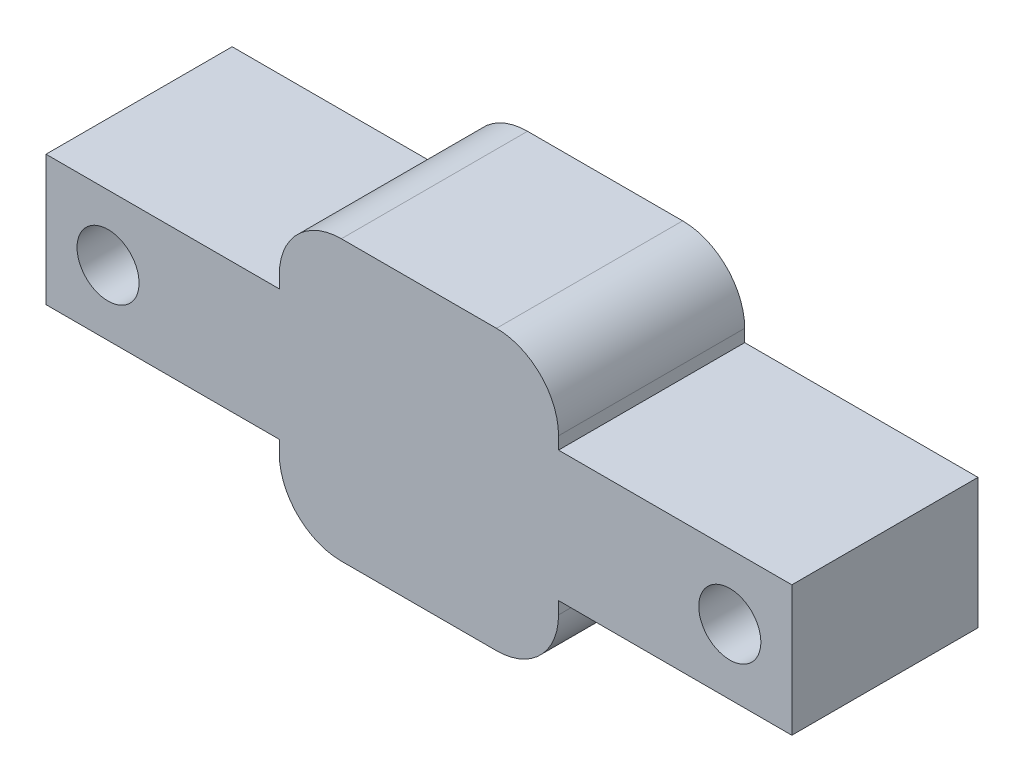
from build123d import *

# Parameters (mm, degrees)
SKETCH2_W           = 28.575
SKETCH2_H           = 28.575
BOSS_EXTRUDE2_DEPTH = 19.05
SKETCH1_R           = 13.335
CUT_EXTRUDE4_DEPTH  = 1.5875
FILLET2_R           = 6.35
SKETCH3_W           = 19.05
SKETCH3_H           = 13.335
BOSS_EXTRUDE3_DEPTH = 23.876
SKETCH4_R           = 3.175
CUT_EXTRUDE5_DEPTH  = 45.983195623
SKETCH6_R           = 4.7625
CUT_EXTRUDE6_DEPTH  = 6.35


with BuildPart() as part:
    # Sketch2 → Boss-Extrude2 (new body)
    with BuildSketch(Plane.XY):
        Rectangle(SKETCH2_W, SKETCH2_H)
    extrude(amount=BOSS_EXTRUDE2_DEPTH)

    # Sketch1 → Cut-Extrude4 (cut)
    with BuildSketch(Plane.XY):
        Circle(SKETCH1_R)
    extrude(amount=CUT_EXTRUDE4_DEPTH, mode=Mode.SUBTRACT)

    # Fillet2
    fillet2_edges = [part.edges().sort_by_distance(p)[0] for p in [
        (14.2875, -14.2875, 9.525),
        (-14.2875, -14.2875, 9.525),
        (-14.2875, 14.2875, 9.525),
        (14.2875, 14.2875, 9.525),
    ]]
    fillet(fillet2_edges, radius=FILLET2_R)

    # Sketch3 → Boss-Extrude3 (add)
    with BuildSketch(Plane(origin=(14.2875, 0, 0), x_dir=(0, 0, -1), z_dir=(1, 0, 0))):
        with Locations((-9.525, 0)):
            Rectangle(SKETCH3_W, SKETCH3_H)
    boss_extrude3 = extrude(amount=BOSS_EXTRUDE3_DEPTH)

    # Sketch4 → Cut-Extrude5 (cut, symmetric)
    with BuildSketch(Plane(origin=(0, 0, 0), x_dir=(-1, 0, 0), z_dir=(0, 0, -1))):
        with Locations((-31.8135, 0)):
            Circle(SKETCH4_R)
    cut_extrude5 = extrude(amount=CUT_EXTRUDE5_DEPTH, both=True, mode=Mode.SUBTRACT)

    # Sketch6 → Cut-Extrude6 (cut)
    with BuildSketch(Plane(origin=(0, 0, 0), x_dir=(-1, 0, 0), z_dir=(0, 0, -1))):
        with Locations((-31.8135, 0)):
            Circle(SKETCH6_R)
    cut_extrude6 = extrude(amount=-CUT_EXTRUDE6_DEPTH, mode=Mode.SUBTRACT)

    # Mirror1: Boss-Extrude3, Cut-Extrude5, Cut-Extrude6 across plane
    add(boss_extrude3.mirror(Plane(origin=(0, 0, 0), x_dir=(0, 0, 1), z_dir=(1, 0, 0))))
    add(cut_extrude5.mirror(Plane(origin=(0, 0, 0), x_dir=(0, 0, 1), z_dir=(1, 0, 0))), mode=Mode.SUBTRACT)
    add(cut_extrude6.mirror(Plane(origin=(0, 0, 0), x_dir=(0, 0, 1), z_dir=(1, 0, 0))), mode=Mode.SUBTRACT)


solid = part.part
